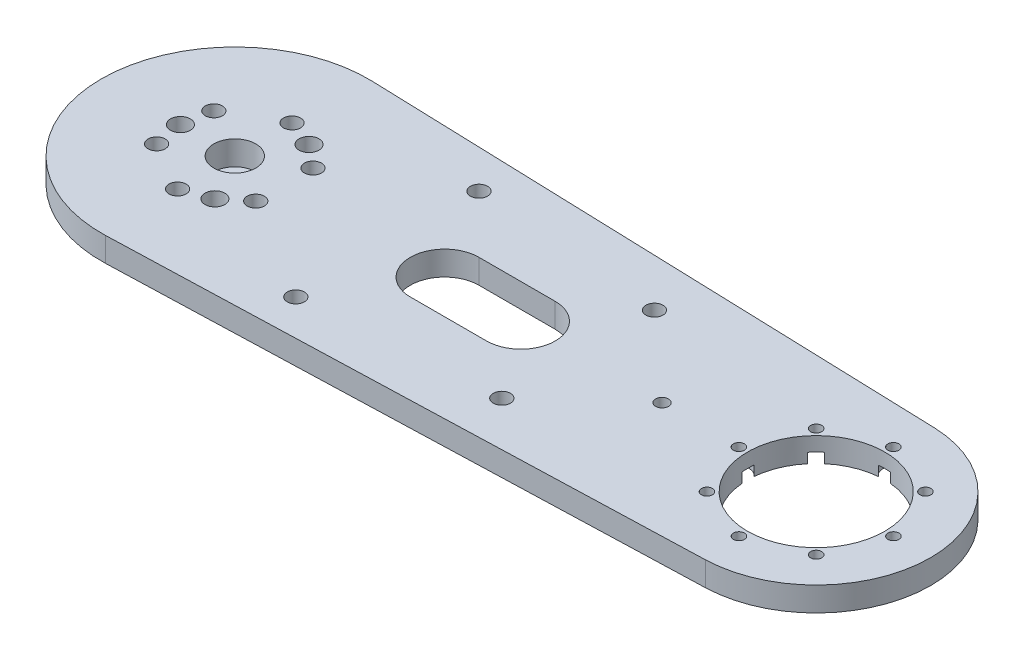
from build123d import *

# Parameters (mm, degrees)
PLACA_START                     = 4
PLACA_DEPTH                     = 6.35
PLACA_R1_START                  = 4
CROQUIS14_R                     = 35
PLACA_R1_DEPTH                  = 6.35
PLACA_R2_START                  = 4
CROQUIS15_R                     = 30
PLACA_R2_DEPTH                  = 6.35
ALIGERADO_START                 = 4
ALIGERADO_DEPTH                 = 6.35
BARRENOS_SEPARADORES_M4_START   = 4
CROQUIS17_R                     = 2.25
BARRENOS_SEPARADORES_M4_DEPTH   = 6.35
BARRENOS_M2_Y_M3_START          = 4
CROQUIS18_R                     = 2.25
CROQUIS18_R_2                   = 2.6
CROQUIS18_R_3                   = 5.5
CROQUIS18_R_4                   = 18
CROQUIS18_R_5                   = 1.45
BARRENOS_M2_Y_M3_DEPTH          = 6.35
REFRENTADO_M4_CABEZA_BAJA_START = 4
CROQUIS19_R                     = 4
REFRENTADO_M4_CABEZA_BAJA_DEPTH = 2.8
REFRENTADO_M2_5_START           = 4
CROQUIS20_R                     = 2.8
REFRENTADO_M2_5_DEPTH           = 2.6
ROSCA_M3_BASES_CINCHO_START     = 4
CROQUIS21_R                     = 1.25
ROSCA_M3_BASES_CINCHO_DEPTH     = 6.35
PASO_M3_BASES_CINCHO_START      = 4
CROQUIS22_R                     = 1.7
PASO_M3_BASES_CINCHO_DEPTH      = 6.35
CROQUIS23_R                     = 10
SALIENTE_EXTRUIR1_DEPTH         = 8
CROQUIS24_R                     = 7.475
CORTAR_EXTRUIR1_DEPTH           = 5.5


with BuildPart() as part:
    # Croquis13 → Placa (new body)
    with BuildSketch(Plane(origin=(0, 0, 0), x_dir=(1, 0, 0), z_dir=(0, 1, 0)).offset(PLACA_START)):
        Polygon((1.148293963, -206.431158085), (153.384251969, -201.433849787), (153.384251969, -141.466150213), (1.148293963, -136.468841915), align=None)
    extrude(amount=PLACA_DEPTH)

    # Croquis14 → Placa_r1 (add)
    with BuildSketch(Plane(origin=(0, 0, 0), x_dir=(1, 0, 0), z_dir=(0, 1, 0)).offset(PLACA_R1_START)):
        with Locations((0, -171.45)):
            Circle(CROQUIS14_R)
    extrude(amount=PLACA_R1_DEPTH)

    # Croquis15 → Placa_r2 (add)
    with BuildSketch(Plane(origin=(0, 0, 0), x_dir=(1, 0, 0), z_dir=(0, 1, 0)).offset(PLACA_R2_START)):
        with Locations((152.4, -171.45)):
            Circle(CROQUIS15_R)
    extrude(amount=PLACA_R2_DEPTH)

    # Croquis16 → Aligerado (cut)
    with BuildSketch(Plane(origin=(0, 0, 0), x_dir=(1, 0, 0), z_dir=(0, 1, 0)).offset(ALIGERADO_START)):
        with BuildLine():
            Line((55, -162.45), (75, -162.45))
            ThreePointArc((75, -162.45), (84, -171.45), (75, -180.45))
            Line((75, -180.45), (55, -180.45))
            ThreePointArc((55, -180.45), (46, -171.45), (55, -162.45))
        make_face()
    extrude(amount=ALIGERADO_DEPTH, mode=Mode.SUBTRACT)

    # Croquis17 → Barrenos_separadores_M4 (cut)
    with BuildSketch(Plane(origin=(0, 0, 0), x_dir=(1, 0, 0), z_dir=(0, 1, 0)).offset(BARRENOS_SEPARADORES_M4_START)):
        with Locations((40, -195.45)):
            Circle(CROQUIS17_R)
        with Locations((40, -147.45)):
            Circle(CROQUIS17_R)
        with Locations((90, -191.45)):
            Circle(CROQUIS17_R)
        with Locations((90, -151.45)):
            Circle(CROQUIS17_R)
    extrude(amount=BARRENOS_SEPARADORES_M4_DEPTH, mode=Mode.SUBTRACT)

    # Croquis18 → Barrenos_M2_y_M3 (cut)
    with BuildSketch(Plane(origin=(0, 0, 0), x_dir=(1, 0, 0), z_dir=(0, 1, 0)).offset(BARRENOS_M2_Y_M3_START)):
        with Locations((12.990381057, -178.95)):
            Circle(CROQUIS18_R)
        with Locations((0, -186.45)):
            Circle(CROQUIS18_R)
        with Locations((-12.990381057, -178.95)):
            Circle(CROQUIS18_R)
        with Locations((-12.990381057, -163.95)):
            Circle(CROQUIS18_R)
        with Locations((0, -156.45)):
            Circle(CROQUIS18_R)
        with Locations((12.990381057, -163.95)):
            Circle(CROQUIS18_R)
        with Locations((7.125, -183.790862004)):
            Circle(CROQUIS18_R_2)
        with Locations((-14.25, -171.45)):
            Circle(CROQUIS18_R_2)
        with Locations((7.125, -159.109137996)):
            Circle(CROQUIS18_R_2)
        with Locations((0, -171.45)):
            Circle(CROQUIS18_R_3)
        with Locations((152.4, -171.45)):
            Circle(CROQUIS18_R_4)
        with Locations((172.65, -171.45)):
            Circle(CROQUIS18_R_5)
        with Locations((166.718912319, -185.768912319)):
            Circle(CROQUIS18_R_5)
        with Locations((152.4, -191.7)):
            Circle(CROQUIS18_R_5)
        with Locations((138.081087681, -185.768912319)):
            Circle(CROQUIS18_R_5)
        with Locations((132.15, -171.45)):
            Circle(CROQUIS18_R_5)
        with Locations((138.081087681, -157.131087681)):
            Circle(CROQUIS18_R_5)
        with Locations((152.4, -151.2)):
            Circle(CROQUIS18_R_5)
        with Locations((166.718912319, -157.131087681)):
            Circle(CROQUIS18_R_5)
    extrude(amount=BARRENOS_M2_Y_M3_DEPTH, mode=Mode.SUBTRACT)

    # Croquis19 → Refrentado_M4_cabeza_baja (cut)
    with BuildSketch(Plane(origin=(0, 0, 0), x_dir=(1, 0, 0), z_dir=(0, 1, 0)).offset(REFRENTADO_M4_CABEZA_BAJA_START)):
        with Locations((12.990381057, -178.95)):
            Circle(CROQUIS19_R)
        with Locations((0, -186.45)):
            Circle(CROQUIS19_R)
        with Locations((-12.990381057, -178.95)):
            Circle(CROQUIS19_R)
        with Locations((-12.990381057, -163.95)):
            Circle(CROQUIS19_R)
        with Locations((0, -156.45)):
            Circle(CROQUIS19_R)
        with Locations((12.990381057, -163.95)):
            Circle(CROQUIS19_R)
    extrude(amount=REFRENTADO_M4_CABEZA_BAJA_DEPTH, mode=Mode.SUBTRACT)

    # Croquis20 → Refrentado_M2-5 (cut)
    with BuildSketch(Plane(origin=(0, 0, 0), x_dir=(1, 0, 0), z_dir=(0, 1, 0)).offset(REFRENTADO_M2_5_START)):
        with Locations((172.65, -171.45)):
            Circle(CROQUIS20_R)
        with Locations((166.718912319, -185.768912319)):
            Circle(CROQUIS20_R)
        with Locations((152.4, -191.7)):
            Circle(CROQUIS20_R)
        with Locations((138.081087681, -185.768912319)):
            Circle(CROQUIS20_R)
        with Locations((132.15, -171.45)):
            Circle(CROQUIS20_R)
        with Locations((138.081087681, -157.131087681)):
            Circle(CROQUIS20_R)
        with Locations((152.4, -151.2)):
            Circle(CROQUIS20_R)
        with Locations((166.718912319, -157.131087681)):
            Circle(CROQUIS20_R)
    extrude(amount=REFRENTADO_M2_5_DEPTH, mode=Mode.SUBTRACT)

    # Croquis21 → Rosca_M3_bases_cincho (cut)
    with BuildSketch(Plane(origin=(0, 0, 0), x_dir=(1, 0, 0), z_dir=(0, 1, 0)).offset(ROSCA_M3_BASES_CINCHO_START)):
        with Locations((112, -171.45)):
            Circle(CROQUIS21_R)
    extrude(amount=ROSCA_M3_BASES_CINCHO_DEPTH, mode=Mode.SUBTRACT)

    # Croquis22 → Paso_M3_bases_cincho (cut)
    with BuildSketch(Plane(origin=(0, 0, 0), x_dir=(1, 0, 0), z_dir=(0, 1, 0)).offset(PASO_M3_BASES_CINCHO_START)):
        with Locations((112, -171.45)):
            Circle(CROQUIS22_R)
    extrude(amount=PASO_M3_BASES_CINCHO_DEPTH, mode=Mode.SUBTRACT)

    # Croquis23 → Saliente-Extruir1 (add)
    with BuildSketch(Plane.XZ.offset(-4)):
        with Locations((0, 171.45)):
            Circle(CROQUIS23_R)
    extrude(amount=SALIENTE_EXTRUIR1_DEPTH)

    # Croquis24 → Cortar-Extruir1 (cut)
    with BuildSketch(Plane.XZ.offset(4)):
        with Locations((0, 171.45)):
            Circle(CROQUIS24_R)
    extrude(amount=-CORTAR_EXTRUIR1_DEPTH, mode=Mode.SUBTRACT)


solid = part.part
